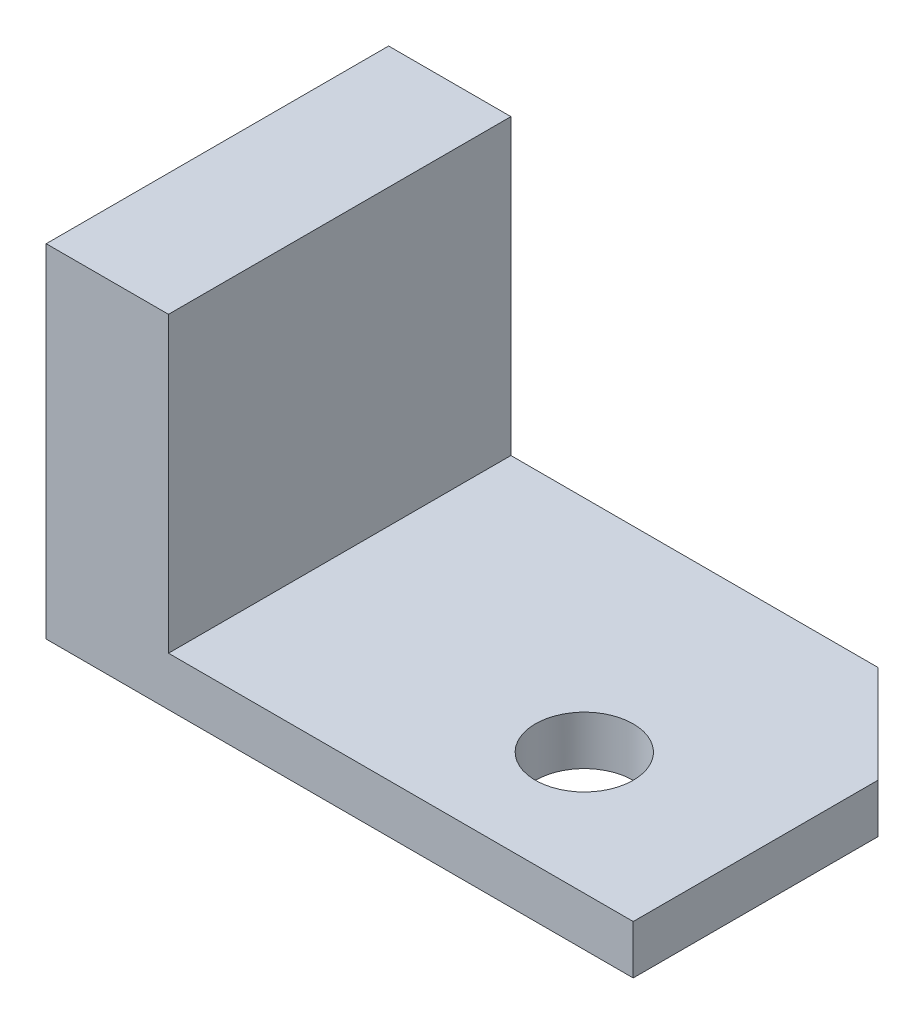
from build123d import *

# Parameters (mm, degrees)
SKETCH1_W           = 120
SKETCH1_H           = 70
BOSS_EXTRUDE1_DEPTH = 10
SKETCH2_W           = 25
SKETCH2_H           = 70
BOSS_EXTRUDE2_DEPTH = 60
SKETCH3_R           = 10
CUT_EXTRUDE1_DEPTH  = 156.563491861
CHAMFER1_SIZE       = 20


with BuildPart() as part:
    # Sketch1 → Boss-Extrude1 (new body)
    with BuildSketch(Plane(origin=(0, 0, 0), x_dir=(1, 0, 0), z_dir=(0, 1, 0))):
        with Locations((60, 35)):
            Rectangle(SKETCH1_W, SKETCH1_H)
    extrude(amount=BOSS_EXTRUDE1_DEPTH)

    # Sketch2 → Boss-Extrude2 (add)
    with BuildSketch(Plane(origin=(0, 10, 0), x_dir=(1, 0, 0), z_dir=(0, 1, 0))):
        with Locations((12.5, 35)):
            Rectangle(SKETCH2_W, SKETCH2_H)
    extrude(amount=BOSS_EXTRUDE2_DEPTH)

    # Sketch3 → Cut-Extrude1 (cut, through all)
    with BuildSketch(Plane(origin=(0, 0, 0), x_dir=(1, 0, 0), z_dir=(0, 1, 0))):
        with Locations(Location((85, 25, 0), (0, 0, 90))):
            Circle(SKETCH3_R)
    extrude(amount=CUT_EXTRUDE1_DEPTH, mode=Mode.SUBTRACT)

    # Chamfer1
    chamfer1_edges = [part.edges().sort_by_distance(p)[0] for p in [
        (120, 5, -70),
    ]]
    chamfer(chamfer1_edges, length=CHAMFER1_SIZE)


solid = part.part
